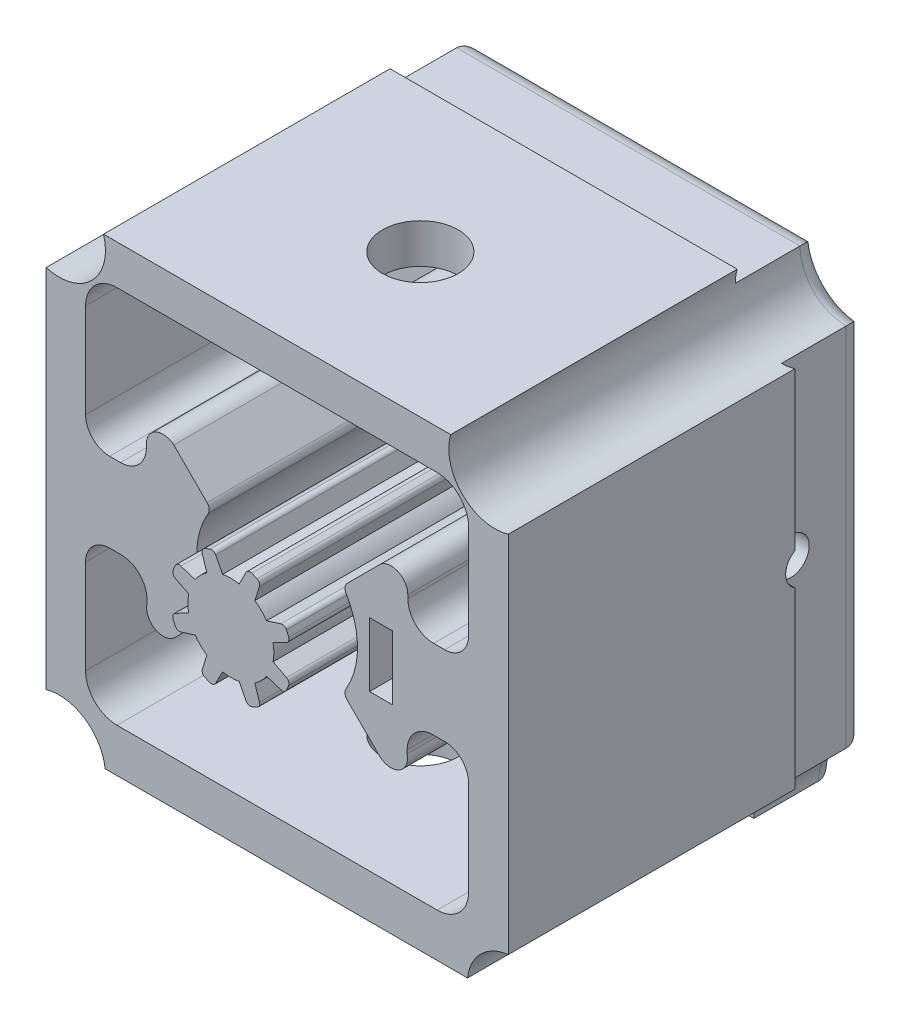
from build123d import *

# Parameters (mm, degrees)
SKETCH2_R               = 3.05
BOSS_EXTRUDE1_DEPTH     = 9
CUT_EXTRUDE4_DEPTH      = 29
CUT_EXTRUDE4_DEPTH_BACK = 38
SKETCH7_R               = 2
CUT_EXTRUDE5_DEPTH      = 2.5
SKETCH13_W              = 50
SKETCH13_H              = 50
BOSS_EXTRUDE4_DEPTH     = 31
SKETCH14_R              = 2
CUT_EXTRUDE8_DEPTH      = 51
SKETCH15_W              = 2.5
SKETCH15_H              = 6.93
CUT_EXTRUDE9_DEPTH      = 32
SKETCH16_R              = 5
CUT_EXTRUDE10_DEPTH     = 48
SKETCH17_R              = 4.1
CUT_EXTRUDE12_DEPTH     = 68
FILLET1_R               = 2
BOSS_EXTRUDE5_DEPTH     = 36


with BuildPart() as part:
    # Sketch2 → Boss-Extrude1 (new body)
    with BuildSketch(Plane.XY.offset(-16.453858319)):
        with BuildLine():
            Line((-19.071404551, 23.571404551), (20.071404551, 23.571404551))
            ThreePointArc((20.071404551, 23.571404551), (21.096530817, 21.096530817), (23.571404551, 20.071404551))
            Line((23.571404551, 20.071404551), (23.571404551, -21.540275677))
            ThreePointArc((23.571404551, -21.540275677), (21.747139916, -23.199696306), (21.071404551, -25.571404551))
            Line((21.071404551, -25.571404551), (-19.071404551, -25.571404551))
            ThreePointArc((-19.071404551, -25.571404551), (-20.389424036, -22.389424036), (-23.571404551, -21.071404551))
            Line((-23.571404551, -21.071404551), (-23.571404551, 19.071404551))
            ThreePointArc((-23.571404551, 19.071404551), (-20.389424036, 20.389424036), (-19.071404551, 23.571404551))
        make_face()
        Circle(SKETCH2_R, mode=Mode.SUBTRACT)
    extrude(amount=BOSS_EXTRUDE1_DEPTH)

    # Sketch7 → Cut-Extrude4 (cut, two sides: drawn at the far end of the back side and taken through both)
    with BuildSketch(Plane(origin=(0, 0, 0), x_dir=(0, 0, -1), z_dir=(1, 0, 0)).offset(-CUT_EXTRUDE4_DEPTH_BACK)):
        with Locations((8.453858319, 0)):
            Circle(SKETCH7_R)
    extrude(amount=CUT_EXTRUDE4_DEPTH + CUT_EXTRUDE4_DEPTH_BACK, mode=Mode.SUBTRACT)

    # Sketch8 → Cut-Extrude5 (cut)
    with BuildSketch(Plane(origin=(10, 0, 0), x_dir=(0, 0, -1), z_dir=(1, 0, 0))):
        Polygon((11.453858319, -1.732050808), (11.453858319, 1.732050808), (8.453858319, 3.464101615), (5.453858319, 1.732050808), (5.453858319, -1.732050808), (8.453858319, -3.464101615), align=None)
    extrude(amount=CUT_EXTRUDE5_DEPTH, mode=Mode.SUBTRACT)

    # Sketch13 → Boss-Extrude4 (add)
    with BuildSketch(Plane.XY.offset(-7.453858319)):
        with Locations((0.016693365, 0)):
            Rectangle(SKETCH13_W, SKETCH13_H)
        with BuildLine():
            Line((-17.320097361, 20.720097361), (-7.120097388, 20.720097361))
            Line((-7.120097388, 20.720097361), (7.120097388, 20.720097361))
            Line((7.120097388, 20.720097361), (17.320097361, 20.720097361))
            ThreePointArc((17.320097361, 20.720097361), (19.724260417, 19.724260417), (20.720097361, 17.320097361))
            Line((20.720097361, 17.320097361), (20.720097361, 7.120097388))
            ThreePointArc((20.720097361, 7.120097388), (19.958574992, 5.281619757), (18.120097361, 4.520097388))
            Line((18.120097361, 4.520097388), (16.940097361, 4.520097388))
            ThreePointArc((16.940097361, 4.520097388), (14.960198374, 5.340198401), (14.140097361, 7.320097388))
            Line((14.140097361, 7.320097388), (14.140097361, 7.680636752))
            ThreePointArc((14.140097361, 7.680636752), (13.092013433, 9.316063981), (11.168294894, 9.04697455))
            Line((11.168294894, 9.04697455), (7.578328467, 5.457008123))
            ThreePointArc((7.578328467, 5.457008123), (7.349986186, 4.988893203), (7.458202195, 4.479421839))
            ThreePointArc((7.458202195, 4.479421839), (8.7, 0), (7.458202195, -4.479421839))
            ThreePointArc((7.458202195, -4.479421839), (7.349986186, -4.988893203), (7.578328466, -5.457008123))
            Line((7.578328466, -5.457008123), (11.040500926, -8.919180582))
            ThreePointArc((11.040500926, -8.919180582), (13.171890638, -9.228415659), (14.074095084, -7.272789013))
            Line((14.074095084, -7.272789013), (14.073931328, -6.880216848))
            ThreePointArc((14.073931328, -6.880216848), (14.919018257, -4.874475137), (16.945324291, -4.079959191))
            Line((16.945324291, -4.079959191), (18.120021383, -4.079924864))
            ThreePointArc((18.120021383, -4.079924864), (19.95854813, -4.84142037), (20.720097361, -6.679924863))
            Line((20.720097361, -6.679924863), (20.720097361, -16.879902639))
            ThreePointArc((20.720097361, -16.879902639), (19.724260417, -19.284065695), (17.320097361, -20.279902639))
            Line((17.320097361, -20.279902639), (7.338286097, -20.279902639))
            Line((7.338286097, -20.279902639), (-7.338286097, -20.279902639))
            Line((-7.338286097, -20.279902639), (-17.320097361, -20.279902639))
            ThreePointArc((-17.320097361, -20.279902639), (-19.724260417, -19.284065695), (-20.720097361, -16.879902639))
            Line((-20.720097361, -16.879902639), (-20.720097361, -6.679924863))
            ThreePointArc((-20.720097361, -6.679924863), (-19.95854813, -4.84142037), (-18.120021383, -4.079924864))
            Line((-18.120021383, -4.079924864), (-16.945324291, -4.079959191))
            ThreePointArc((-16.945324291, -4.079959191), (-14.919018257, -4.874475137), (-14.073931328, -6.880216848))
            Line((-14.073931328, -6.880216848), (-14.074095084, -7.272789013))
            ThreePointArc((-14.074095084, -7.272789013), (-13.171890638, -9.228415659), (-11.040500926, -8.919180582))
            Line((-11.040500926, -8.919180582), (-7.578328466, -5.457008123))
            ThreePointArc((-7.578328466, -5.457008123), (-7.349986186, -4.988893203), (-7.458202195, -4.479421839))
            ThreePointArc((-7.458202195, -4.479421839), (-8.7, 0), (-7.458202195, 4.479421839))
            ThreePointArc((-7.458202195, 4.479421839), (-7.349986186, 4.988893203), (-7.578328467, 5.457008123))
            Line((-7.578328467, 5.457008123), (-11.168294894, 9.04697455))
            ThreePointArc((-11.168294894, 9.04697455), (-13.092013433, 9.316063981), (-14.140097361, 7.680636752))
            Line((-14.140097361, 7.680636752), (-14.140097361, 7.320097388))
            ThreePointArc((-14.140097361, 7.320097388), (-14.960198374, 5.340198401), (-16.940097361, 4.520097388))
            Line((-16.940097361, 4.520097388), (-18.120097361, 4.520097388))
            ThreePointArc((-18.120097361, 4.520097388), (-19.958574992, 5.281619757), (-20.720097361, 7.120097388))
            Line((-20.720097361, 7.120097388), (-20.720097361, 17.320097361))
            ThreePointArc((-20.720097361, 17.320097361), (-19.724260417, 19.724260417), (-17.320097361, 20.720097361))
        make_face(mode=Mode.SUBTRACT)
    extrude(amount=BOSS_EXTRUDE4_DEPTH)

    # Sketch14 → Cut-Extrude8 (cut)
    with BuildSketch(Plane.ZY.offset(24.983306635)):
        with Locations(Location((-8.453858319, 0, 0), (0, 0, 300))):
            Circle(SKETCH14_R)
    extrude(amount=-CUT_EXTRUDE8_DEPTH, mode=Mode.SUBTRACT)

    # Sketch15 → Cut-Extrude9 (cut)
    with BuildSketch(Plane.XY.offset(23.546141681)):
        with Locations((11.25, 0)):
            Rectangle(SKETCH15_W, SKETCH15_H)
    extrude(amount=-CUT_EXTRUDE9_DEPTH, mode=Mode.SUBTRACT)

    # Sketch16 → Cut-Extrude10 (cut)
    with BuildSketch(Plane(origin=(0, 0, -16.453858319), x_dir=(-1, 0, 0), z_dir=(0, 0, -1))):
        with Locations((23.571404551, 23.571404551)):
            Circle(SKETCH16_R)
        with Locations((-23.571404551, 23.571404551)):
            Circle(SKETCH16_R)
        with Locations((-25.571404551, -25.571404551)):
            Circle(SKETCH16_R)
        with Locations((23.571404551, -25.571404551)):
            Circle(SKETCH16_R)
    extrude(amount=-CUT_EXTRUDE10_DEPTH, mode=Mode.SUBTRACT)

    # Sketch17 → Cut-Extrude12 (cut)
    with BuildSketch(Plane(origin=(0, 25, 0), x_dir=(1, 0, 0), z_dir=(0, 1, 0))):
        with Locations(Location((0, -8.046141681, 0), (0, 0, 90))):
            Circle(SKETCH17_R)
    extrude(amount=-CUT_EXTRUDE12_DEPTH, mode=Mode.SUBTRACT)

    # Fillet1
    fillet1_edges = [part.edges().sort_by_distance(p)[0] for p in [
        (0, 23.571404551, -16.453858319),
        (23.571404551, -1.208712153, -16.453858319),
        (1, -25.571404551, -16.453858319),
        (-23.571404551, -1, -16.453858319),
        (21.388104418, -22.832791763, -16.453858319),
        (-20.035870645, 20.035870645, -16.453858319),
        (-20.035870645, -22.035870645, -16.453858319),
        (20.035870645, 20.035870645, -16.453858319),
    ]]
    fillet(fillet1_edges, radius=FILLET1_R)

    # Sketch20 → Boss-Extrude5 (add)
    with BuildSketch(Plane.XY.offset(-7.453858319)):
        with BuildLine():
            Line((-0.894224281, 4.563207527), (-1.642210721, 6.014281308))
            ThreePointArc((-1.642210721, 6.014281308), (-1.903809747, 6.250564892), (-2.256285725, 6.25553153))
            ThreePointArc((-2.256285725, 6.25553153), (-2.545103004, 6.143691944), (-2.828399672, 6.018526007))
            ThreePointArc((-2.828399672, 6.018526007), (-3.074104639, 5.765755257), (-3.091975771, 5.413697585))
            Line((-3.091975771, 5.413697585), (-2.594687257, 3.85876898))
            ThreePointArc((-2.594687257, 3.85876898), (-3.288184703, 3.287908356), (-3.858987039, 2.594362934))
            Line((-3.858987039, 2.594362934), (-5.413957434, 3.09152076))
            ThreePointArc((-5.413957434, 3.09152076), (-5.766013604, 3.073620039), (-6.018763701, 2.827893829))
            ThreePointArc((-6.018763701, 2.827893829), (-6.143905828, 2.544586642), (-6.25572114, 2.255759964))
            ThreePointArc((-6.25572114, 2.255759964), (-6.250724877, 1.903284405), (-6.014419308, 1.641705239))
            Line((-6.014419308, 1.641705239), (-4.563282667, 0.893840758))
            ThreePointArc((-4.563282667, 0.893840758), (-4.649999996, -0.000195407), (-4.563207527, -0.894224281))
            Line((-4.563207527, -0.894224281), (-6.014281308, -1.642210721))
            ThreePointArc((-6.014281308, -1.642210721), (-6.250564892, -1.903809747), (-6.25553153, -2.256285725))
            ThreePointArc((-6.25553153, -2.256285725), (-6.143691944, -2.545103004), (-6.018526007, -2.828399672))
            ThreePointArc((-6.018526007, -2.828399672), (-5.765755257, -3.074104639), (-5.413697585, -3.091975771))
            Line((-5.413697585, -3.091975771), (-3.85876898, -2.594687257))
            ThreePointArc((-3.85876898, -2.594687257), (-3.287908356, -3.288184703), (-2.594362934, -3.858987039))
            Line((-2.594362934, -3.858987039), (-3.09152076, -5.413957434))
            ThreePointArc((-3.09152076, -5.413957434), (-3.073620039, -5.766013604), (-2.827893829, -6.018763701))
            ThreePointArc((-2.827893829, -6.018763701), (-2.544586642, -6.143905828), (-2.255759964, -6.25572114))
            ThreePointArc((-2.255759964, -6.25572114), (-1.903284405, -6.250724877), (-1.641705239, -6.014419308))
            Line((-1.641705239, -6.014419308), (-0.893840758, -4.563282667))
            ThreePointArc((-0.893840758, -4.563282667), (0.000195407, -4.649999996), (0.894224281, -4.563207527))
            Line((0.894224281, -4.563207527), (1.642210721, -6.014281308))
            ThreePointArc((1.642210721, -6.014281308), (1.903809747, -6.250564892), (2.256285725, -6.25553153))
            ThreePointArc((2.256285725, -6.25553153), (2.545103004, -6.143691944), (2.828399672, -6.018526007))
            ThreePointArc((2.828399672, -6.018526007), (3.074104639, -5.765755257), (3.091975771, -5.413697585))
            Line((3.091975771, -5.413697585), (2.594687257, -3.85876898))
            ThreePointArc((2.594687257, -3.85876898), (3.288184703, -3.287908356), (3.858987039, -2.594362934))
            Line((3.858987039, -2.594362934), (5.413957434, -3.09152076))
            ThreePointArc((5.413957434, -3.09152076), (5.766013604, -3.073620039), (6.018763701, -2.827893829))
            ThreePointArc((6.018763701, -2.827893829), (6.143905828, -2.544586642), (6.25572114, -2.255759964))
            ThreePointArc((6.25572114, -2.255759964), (6.250724877, -1.903284405), (6.014419308, -1.641705239))
            Line((6.014419308, -1.641705239), (4.563282667, -0.893840758))
            ThreePointArc((4.563282667, -0.893840758), (4.649999996, 0.000195407), (4.563207527, 0.894224281))
            Line((4.563207527, 0.894224281), (6.014281308, 1.642210721))
            ThreePointArc((6.014281308, 1.642210721), (6.250564892, 1.903809747), (6.25553153, 2.256285725))
            ThreePointArc((6.25553153, 2.256285725), (6.143691944, 2.545103004), (6.018526007, 2.828399672))
            ThreePointArc((6.018526007, 2.828399672), (5.765755257, 3.074104639), (5.413697585, 3.091975771))
            Line((5.413697585, 3.091975771), (3.85876898, 2.594687257))
            ThreePointArc((3.85876898, 2.594687257), (3.287908356, 3.288184703), (2.594362934, 3.858987039))
            Line((2.594362934, 3.858987039), (3.09152076, 5.413957434))
            ThreePointArc((3.09152076, 5.413957434), (3.073620039, 5.766013604), (2.827893829, 6.018763701))
            ThreePointArc((2.827893829, 6.018763701), (2.544586642, 6.143905828), (2.255759964, 6.25572114))
            ThreePointArc((2.255759964, 6.25572114), (1.903284405, 6.250724877), (1.641705239, 6.014419308))
            Line((1.641705239, 6.014419308), (0.893840758, 4.563282667))
            ThreePointArc((0.893840758, 4.563282667), (-0.000195407, 4.649999996), (-0.894224281, 4.563207527))
        make_face()
    extrude(amount=BOSS_EXTRUDE5_DEPTH)


solid = part.part
